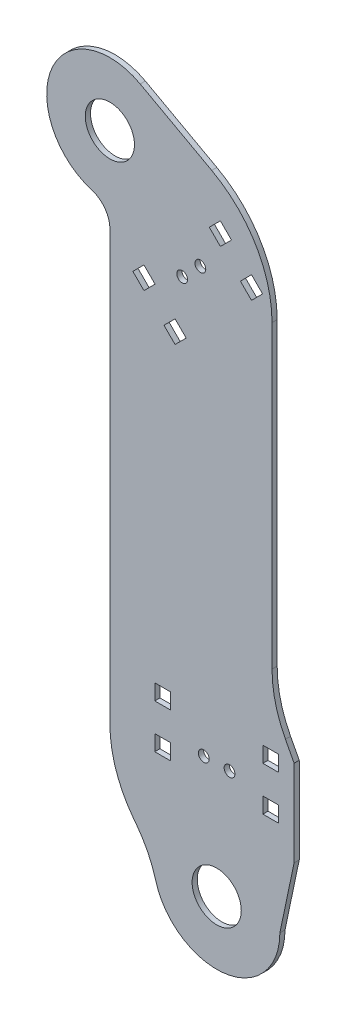
from build123d import *

# Parameters (mm, degrees)
SKETCH_1_W      = 6.1
SKETCH_1_H      = 6.1
SKETCH_1_R      = 9.55
SKETCH_1_R_2    = 2.1
EXTRUDE_2_DEPTH = 2
FILLET_1_R      = 45
FILLET_2_R      = 10


with BuildPart() as part:
    # 草图1 → 凸台-拉伸2 (new body)
    with BuildSketch(Plane.XY):
        with BuildLine():
            Line((-10.195923298, 166.045688989), (-10.195923298, 93.338899377))
            Line((-10.195923298, 93.338899377), (-10.195923298, -3.112918115))
            Line((-10.195923298, -3.112918115), (6.754076702, -25.161100623))
            ThreePointArc((6.754076702, -25.161100623), (31.304076702, -49.711100623), (55.854076702, -25.161100623))
            Line((55.854076702, -25.161100623), (61.387071712, 1.202006387))
            Line((61.387071712, 1.202006387), (61.387071712, 34.710258927))
            Line((61.387071712, 34.710258927), (52.804076702, 50.954174352))
            Line((52.804076702, 50.954174352), (52.804076702, 93.338899377))
            Line((52.804076702, 93.338899377), (52.804076702, 205.407441872))
            Line((52.804076702, 205.407441872), (1.570402993, 233.385501559))
            ThreePointArc((1.570402993, 233.385501559), (-33.983226461, 217.910695504), (-10.195923298, 187.288899377))
            Line((-10.195923298, 187.288899377), (-10.195923298, 166.045688989))
        make_face()
        with Locations((10.304076702, 14.560258927)):
            Rectangle(SKETCH_1_W, SKETCH_1_H, mode=Mode.SUBTRACT)
        with Locations((10.304076702, 31.660258927)):
            Rectangle(SKETCH_1_W, SKETCH_1_H, mode=Mode.SUBTRACT)
        with Locations((31.304076702, -25.161100623)):
            Circle(SKETCH_1_R, mode=Mode.SUBTRACT)
        with Locations((26.304076702, 19.560258927)):
            Circle(SKETCH_1_R_2, mode=Mode.SUBTRACT)
        with Locations((36.304076702, 19.560258927)):
            Circle(SKETCH_1_R_2, mode=Mode.SUBTRACT)
        with Locations((52.304076702, 14.560258927)):
            Rectangle(SKETCH_1_W, SKETCH_1_H, mode=Mode.SUBTRACT)
        with Locations((52.304076702, 31.660258927)):
            Rectangle(SKETCH_1_W, SKETCH_1_H, mode=Mode.SUBTRACT)
        Polygon((7.355428358, 168.902414276), (3.042076993, 164.589062911), (-1.271274372, 168.902414276), (3.042076993, 173.215765641), align=None, mode=Mode.SUBTRACT)
        with Locations((-10.195923298, 211.838899377)):
            Circle(SKETCH_1_R, mode=Mode.SUBTRACT)
        Polygon((19.446954316, 156.810888318), (15.133602951, 152.497536952), (10.820251586, 156.810888318), (15.133602951, 161.124239683), align=None, mode=Mode.SUBTRACT)
        with Locations((17.891319398, 176.680588869)):
            Circle(SKETCH_1_R_2, mode=Mode.SUBTRACT)
        with Locations((24.96238721, 183.751656681)):
            Circle(SKETCH_1_R_2, mode=Mode.SUBTRACT)
        Polygon((32.740561803, 202.914250451), (37.053913168, 198.600899086), (32.740561803, 194.28754772), (28.427210437, 198.600899086), align=None, mode=Mode.SUBTRACT)
        Polygon((49.145439126, 186.509373127), (44.832087761, 182.196021762), (40.518736396, 186.509373127), (44.832087761, 190.822724493), align=None, mode=Mode.SUBTRACT)
    extrude(amount=EXTRUDE_2_DEPTH)

    # 圆角1
    fillet_1_edges = [part.edges().sort_by_distance(p)[0] for p in [
        (-10.195923298, -3.112918115, 1),
        (52.804076702, 205.407441872, 1),
        (52.804076702, 50.954174352, 1),
        (6.754076702, -25.161100623, 1),
    ]]
    fillet(fillet_1_edges, radius=FILLET_1_R)

    # 圆角2
    fillet_2_edges = [part.edges().sort_by_distance(p)[0] for p in [
        (-10.195923298, 187.288899377, 1),
    ]]
    fillet(fillet_2_edges, radius=FILLET_2_R)


solid = part.part
